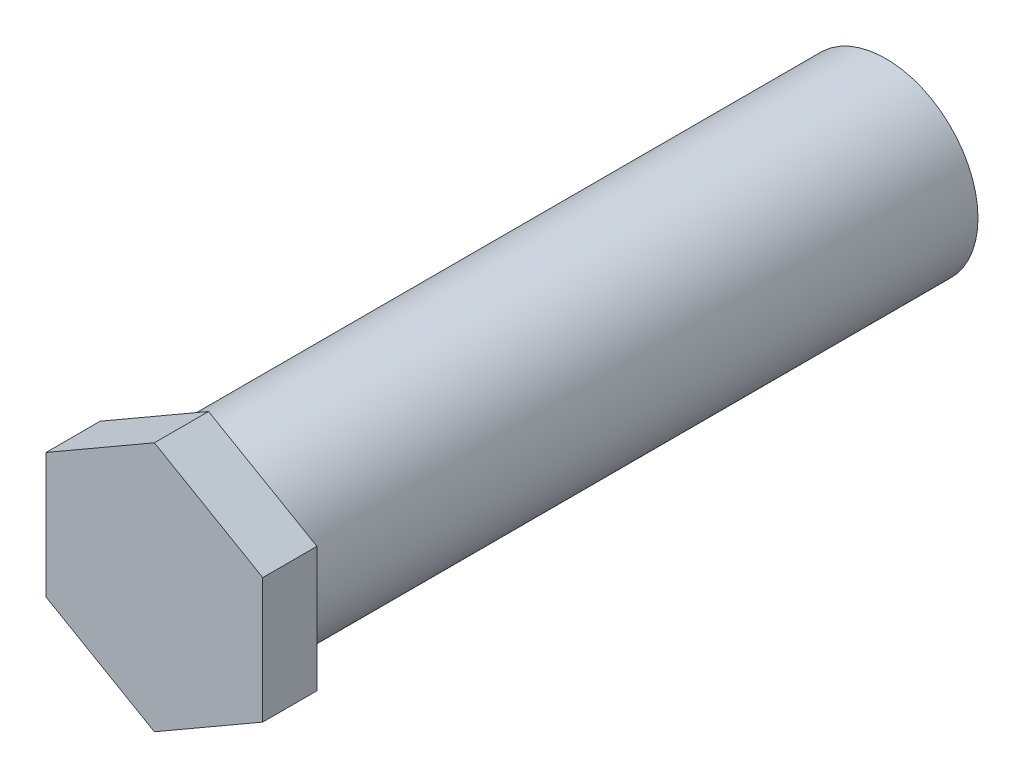
from build123d import *

# Parameters (mm, degrees)
SKETCH1_R           = 3.4
BOSS_EXTRUDE1_DEPTH = 25
BOSS_EXTRUDE2_DEPTH = 2


with BuildPart() as part:
    # Sketch1 → Boss-Extrude1 (new body)
    with BuildSketch(Plane.XY):
        Circle(SKETCH1_R)
    extrude(amount=-BOSS_EXTRUDE1_DEPTH)

    # Sketch2 → Boss-Extrude2 (add)
    with BuildSketch(Plane.XY):
        Polygon((-4, -2.309401077), (0, -4.618802154), (4, -2.309401077), (4, 2.309401077), (0, 4.618802154), (-4, 2.309401077), align=None)
    extrude(amount=BOSS_EXTRUDE2_DEPTH)


solid = part.part
